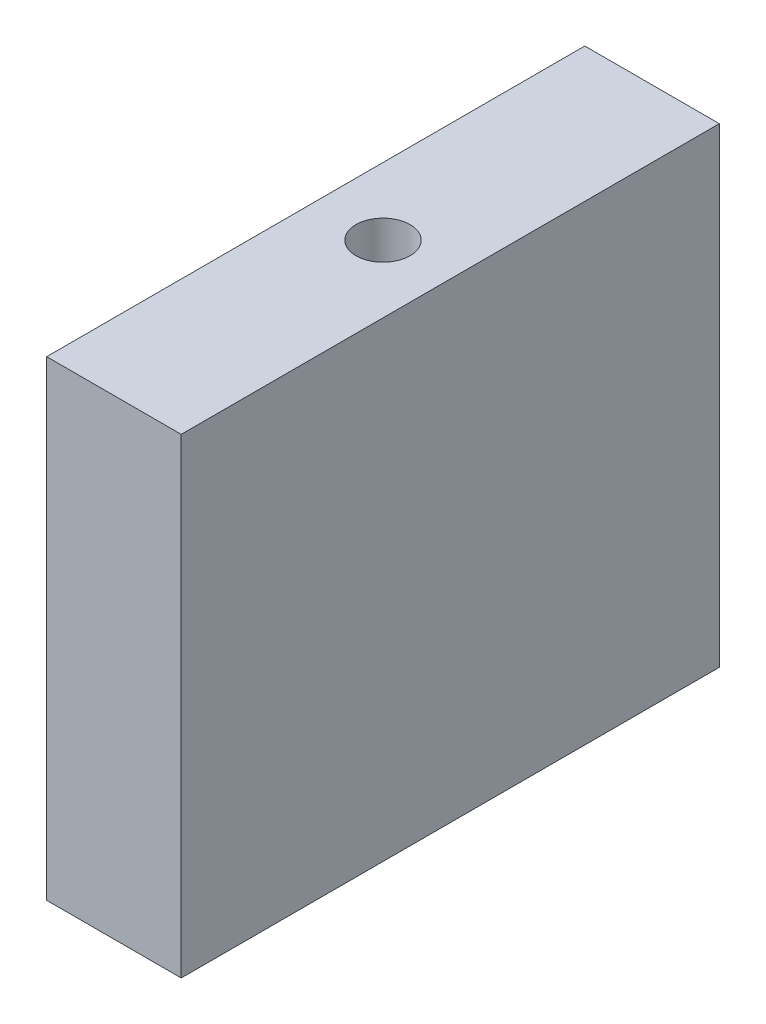
from build123d import *

# Parameters (mm, degrees)
SKETCH1_W                         = 50.8
SKETCH1_H                         = 44.45
EXTRUDE1_DEPTH                    = 6.35
F_1_4_20_TAPPED_HOLE1_D           = 5.1054
F_1_4_20_TAPPED_HOLE1_DEPTH       = 14.9098
F_1_4_20_TAPPED_HOLE1_CSINK_D     = 8.3312
F_1_4_20_TAPPED_HOLE1_CSINK_ANGLE = 82
F_1_4_20_TAPPED_HOLE1_TIP         = 1.533816902
F_1_4_20_TAPPED_HOLE2_D           = 5.1054
F_1_4_20_TAPPED_HOLE2_DEPTH       = 16.51
F_1_4_20_TAPPED_HOLE2_TIP         = 1.533816902


with BuildPart() as part:
    # Sketch1 → Extrude1 (new, symmetric)
    with BuildSketch(Plane(origin=(0, 0, 0), x_dir=(0, 0, -1), z_dir=(1, 0, 0))):
        with Locations((-9.525, 3.175)):
            Rectangle(SKETCH1_W, SKETCH1_H)
    extrude(amount=EXTRUDE1_DEPTH, both=True)

    # 1/4-20 Tapped Hole1
    with Locations(Plane.XZ.offset(19.05)):
        with Locations((0, 26.035), (0, -5.715)):
            CounterSinkHole(F_1_4_20_TAPPED_HOLE1_D / 2, F_1_4_20_TAPPED_HOLE1_CSINK_D / 2, depth=F_1_4_20_TAPPED_HOLE1_DEPTH, counter_sink_angle=F_1_4_20_TAPPED_HOLE1_CSINK_ANGLE)
            with Locations((0, 0, -(F_1_4_20_TAPPED_HOLE1_DEPTH + F_1_4_20_TAPPED_HOLE1_TIP / 2))):  # 118° drill point
                Cone(0, F_1_4_20_TAPPED_HOLE1_D / 2, F_1_4_20_TAPPED_HOLE1_TIP, mode=Mode.SUBTRACT)

    # 1/4-20 Tapped Hole2
    with Locations(Plane(origin=(0, 25.4, 0), x_dir=(-1, 0, 0), z_dir=(0, 1, 0))):
        with Locations((0, 9.525)):
            Hole(F_1_4_20_TAPPED_HOLE2_D / 2, depth=F_1_4_20_TAPPED_HOLE2_DEPTH)
            with Locations((0, 0, -(F_1_4_20_TAPPED_HOLE2_DEPTH + F_1_4_20_TAPPED_HOLE2_TIP / 2))):  # 118° drill point
                Cone(0, F_1_4_20_TAPPED_HOLE2_D / 2, F_1_4_20_TAPPED_HOLE2_TIP, mode=Mode.SUBTRACT)


solid = part.part
